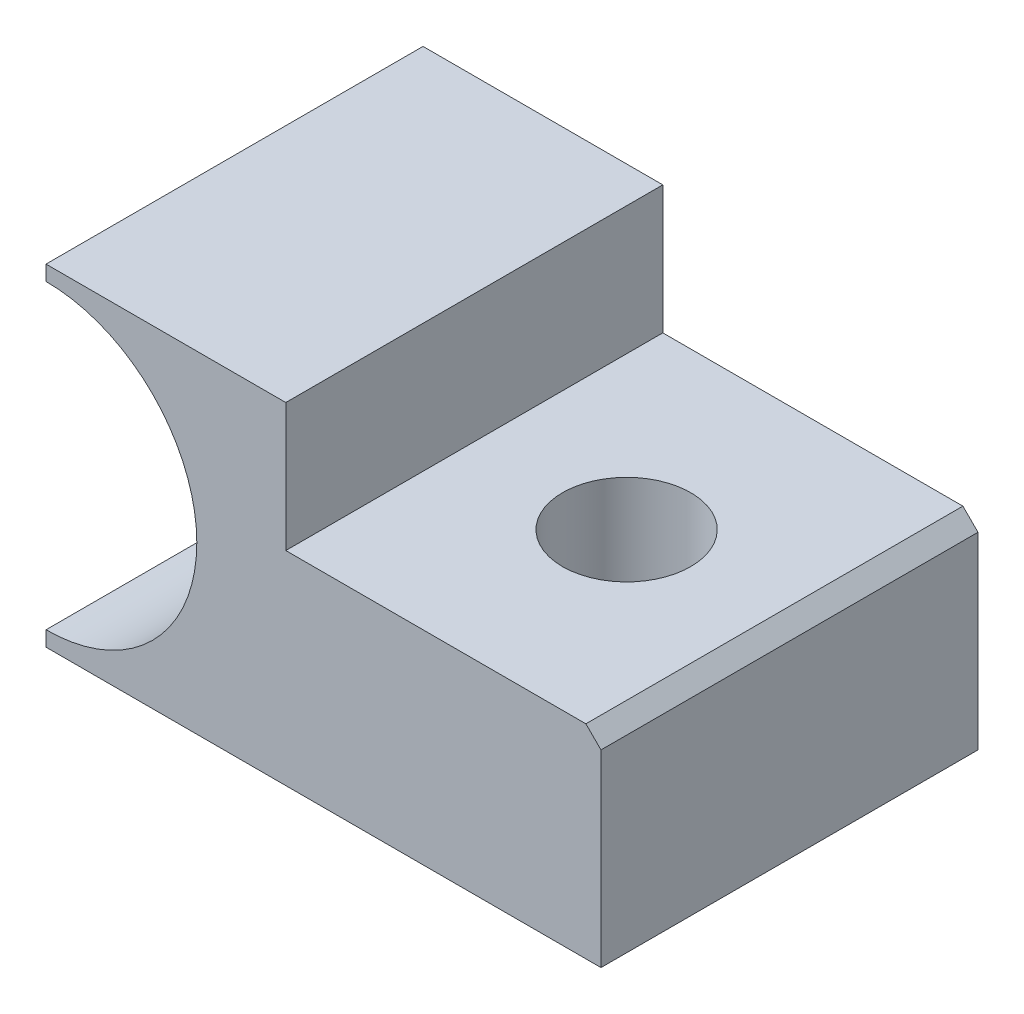
from build123d import *

# Parameters (mm, degrees)
BOSS_EXTRUDE1_DEPTH      = 31.75
X_0_397_DIAMETER_HOLE1_D = 10.795
CHAMFER1_SIZE            = 1.27


with BuildPart() as part:
    # Sketch1 → Boss-Extrude1 (new body)
    with BuildSketch(Plane.XY):
        with BuildLine():
            Line((46.736, 0), (46.736, 17.145))
            Line((46.736, 17.145), (20.193, 17.145))
            Line((20.193, 17.145), (20.193, 27.94))
            Line((20.193, 27.94), (0, 27.94))
            Line((0, 27.94), (0, 26.67))
            ThreePointArc((0, 26.67), (12.7, 13.97), (0, 1.27))
            Line((0, 1.27), (0, 0))
            Line((0, 0), (46.736, 0))
        make_face()
    extrude(amount=BOSS_EXTRUDE1_DEPTH)

    # X (0.397) Diameter Hole1 (through all)
    with Locations(Plane(origin=(0, 17.145, 0), x_dir=(1, 0, 0), z_dir=(0, 1, 0))):
        with Locations((33.02, -15.875)):
            Hole(X_0_397_DIAMETER_HOLE1_D / 2)

    # Chamfer1
    chamfer1_edges = [part.edges().sort_by_distance(p)[0] for p in [
        (46.736, 17.145, 15.875),
    ]]
    chamfer(chamfer1_edges, length=CHAMFER1_SIZE)


solid = part.part
